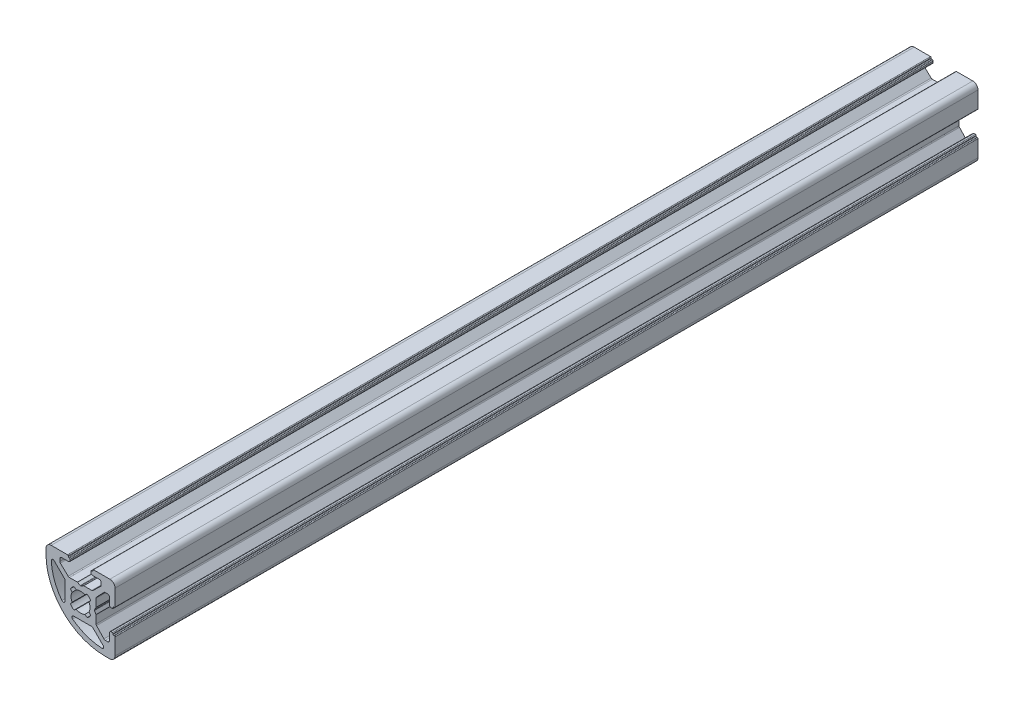
from build123d import *

# Parameters (mm, degrees)
EXTRUDE1_DEPTH = 250


with BuildPart() as part:
    # Sketch1 → Extrude1 (new body)
    with BuildSketch(Plane.XY):
        with BuildLine():
            Line((3.232233116, 4.565447254), (0.953589838, 4.565447254))
            ThreePointArc((0.953589838, 4.565447254), (0.901826028, 4.558632419), (0.853589836, 4.538652333))
            Line((0.853589836, 4.538652333), (0.100000003, 4.103567024))
            ThreePointArc((0.100000003, 4.103567024), (0, 4.076772104), (-0.100000003, 4.103567024))
            Line((-0.100000003, 4.103567024), (-0.853589836, 4.538652333))
            ThreePointArc((-0.853589836, 4.538652333), (-0.901826028, 4.558632419), (-0.953589838, 4.565447254))
            Line((-0.953589838, 4.565447254), (-3.232233116, 4.565447254))
            ThreePointArc((-3.232233116, 4.565447254), (-3.417445277, 4.601015929), (-3.576306433, 4.702661433))
            Line((-3.576306433, 4.702661433), (-5.844073317, 6.853456827))
            ThreePointArc((-5.844073317, 6.853456827), (-5.959367314, 7.018804885), (-6, 7.216242649))
            Line((-6, 7.216242649), (-6, 7.948478858))
            ThreePointArc((-6, 7.948478858), (-5.855954134, 8.296236342), (-5.50819665, 8.440282208))
            Line((-5.50819665, 8.440282208), (-3.49180335, 8.440282208))
            ThreePointArc((-3.49180335, 8.440282208), (-3.144045866, 8.584328074), (-3, 8.932085558))
            Line((-3, 8.932085558), (-3, 9.249999634))
            ThreePointArc((-3, 9.249999634), (-3.058578644, 9.39142099), (-3.2, 9.449999634))
            Line((-3.2, 9.449999634), (-3.350000366, 9.449999634))
            ThreePointArc((-3.350000366, 9.449999634), (-3.491421722, 9.508578278), (-3.550000366, 9.649999634))
            Line((-3.550000366, 9.649999634), (-3.550000366, 9.8))
            ThreePointArc((-3.550000366, 9.8), (-3.60857901, 9.941421356), (-3.750000366, 10))
            Line((-3.750000366, 10), (-8.50000115, 10))
            ThreePointArc((-8.50000115, 10), (-9.560660508, 9.560660508), (-10, 8.50000115))
            Line((-10, 8.50000115), (-10, 7))
            ThreePointArc((-10, 7), (-5.02081528, -5.02081528), (7, -10))
            Line((7, -10), (8.50000115, -10))
            ThreePointArc((8.50000115, -10), (9.560660508, -9.560660508), (10, -8.50000115))
            Line((10, -8.50000115), (10, -3.750000366))
            ThreePointArc((10, -3.750000366), (9.941421356, -3.60857901), (9.8, -3.550000366))
            Line((9.8, -3.550000366), (9.649999634, -3.550000366))
            ThreePointArc((9.649999634, -3.550000366), (9.508578278, -3.491421722), (9.449999634, -3.350000366))
            Line((9.449999634, -3.350000366), (9.449999634, -3.2))
            ThreePointArc((9.449999634, -3.2), (9.39142099, -3.058578644), (9.249999634, -3))
            Line((9.249999634, -3), (8.866638303, -3))
            ThreePointArc((8.866638303, -3), (8.518880819, -3.144045866), (8.374834953, -3.49180335))
            Line((8.374834953, -3.49180335), (8.374834953, -5.50819665))
            ThreePointArc((8.374834953, -5.50819665), (8.230789087, -5.855954134), (7.883031603, -6))
            Line((7.883031603, -6), (7.150795394, -6))
            ThreePointArc((7.150795394, -6), (6.95335763, -5.959367314), (6.788009572, -5.844073317))
            Line((6.788009572, -5.844073317), (4.637214178, -3.576306432))
            ThreePointArc((4.637214178, -3.576306432), (4.535568675, -3.417445276), (4.5, -3.232233115))
            Line((4.5, -3.232233115), (4.5, -0.953589838))
            ThreePointArc((4.5, -0.953589838), (4.493185165, -0.901826026), (4.473205078, -0.853589834))
            Line((4.473205078, -0.853589834), (4.038119764, -0.100000004))
            ThreePointArc((4.038119764, -0.100000004), (4.011324842, 0), (4.038119764, 0.100000004))
            Line((4.038119764, 0.100000004), (4.473205078, 0.853589834))
            ThreePointArc((4.473205078, 0.853589834), (4.493185165, 0.901826026), (4.5, 0.953589838))
            Line((4.5, 0.953589838), (4.5, 3.232233115))
            ThreePointArc((4.5, 3.232233115), (4.535568675, 3.417445276), (4.637214178, 3.576306432))
            Line((4.637214178, 3.576306432), (6.788009572, 5.844073317))
            ThreePointArc((6.788009572, 5.844073317), (6.95335763, 5.959367314), (7.150795394, 6))
            Line((7.150795394, 6), (7.883031603, 6))
            ThreePointArc((7.883031603, 6), (8.230789087, 5.855954134), (8.374834953, 5.50819665))
            Line((8.374834953, 5.50819665), (8.374834953, 3.49180335))
            ThreePointArc((8.374834953, 3.49180335), (8.518880819, 3.144045866), (8.866638303, 3))
            Line((8.866638303, 3), (9.249999634, 3))
            ThreePointArc((9.249999634, 3), (9.39142099, 3.058578644), (9.449999634, 3.2))
            Line((9.449999634, 3.2), (9.449999634, 3.350000366))
            ThreePointArc((9.449999634, 3.350000366), (9.508578278, 3.491421722), (9.649999634, 3.550000366))
            Line((9.649999634, 3.550000366), (9.8, 3.550000366))
            ThreePointArc((9.8, 3.550000366), (9.941421356, 3.60857901), (10, 3.750000366))
            Line((10, 3.750000366), (10, 8.50000115))
            ThreePointArc((10, 8.50000115), (9.560660508, 9.560660508), (8.50000115, 10))
            Line((8.50000115, 10), (3.750000366, 10))
            ThreePointArc((3.750000366, 10), (3.60857901, 9.941421356), (3.550000366, 9.8))
            Line((3.550000366, 9.8), (3.550000366, 9.649999634))
            ThreePointArc((3.550000366, 9.649999634), (3.491421722, 9.508578278), (3.350000366, 9.449999634))
            Line((3.350000366, 9.449999634), (3.2, 9.449999634))
            ThreePointArc((3.2, 9.449999634), (3.058578644, 9.39142099), (3, 9.249999634))
            Line((3, 9.249999634), (3, 8.932085558))
            ThreePointArc((3, 8.932085558), (3.144045866, 8.584328074), (3.49180335, 8.440282208))
            Line((3.49180335, 8.440282208), (5.50819665, 8.440282208))
            ThreePointArc((5.50819665, 8.440282208), (5.855954134, 8.296236342), (6, 7.948478858))
            Line((6, 7.948478858), (6, 7.216242649))
            ThreePointArc((6, 7.216242649), (5.959367314, 7.018804885), (5.844073317, 6.853456827))
            Line((5.844073317, 6.853456827), (3.576306433, 4.702661433))
            ThreePointArc((3.576306433, 4.702661433), (3.417445277, 4.601015929), (3.232233116, 4.565447254))
        make_face()
        with BuildLine():
            Line((1.258185436, 2.445295362), (1.887055008, 2.947714945))
            ThreePointArc((1.887055008, 2.947714945), (2.474873794, 2.474873674), (2.947715037, 1.887054865))
            Line((2.947715037, 1.887054865), (2.445295423, 1.258185317))
            ThreePointArc((2.445295423, 1.258185317), (2.75, -6.7e-08), (2.445295362, -1.258185436))
            Line((2.445295362, -1.258185436), (2.947714945, -1.887055008))
            ThreePointArc((2.947714945, -1.887055008), (2.474873674, -2.474873794), (1.887054865, -2.947715037))
            Line((1.887054865, -2.947715037), (1.258185317, -2.445295423))
            ThreePointArc((1.258185317, -2.445295423), (-6.7e-08, -2.75), (-1.258185436, -2.445295362))
            Line((-1.258185436, -2.445295362), (-1.887055008, -2.947714945))
            ThreePointArc((-1.887055008, -2.947714945), (-2.474873794, -2.474873674), (-2.947715037, -1.887054865))
            Line((-2.947715037, -1.887054865), (-2.445295423, -1.258185317))
            ThreePointArc((-2.445295423, -1.258185317), (-2.75, 6.7e-08), (-2.445295362, 1.258185436))
            Line((-2.445295362, 1.258185436), (-2.947714945, 1.887055008))
            ThreePointArc((-2.947714945, 1.887055008), (-2.474873674, 2.474873794), (-1.887054865, 2.947715037))
            Line((-1.887054865, 2.947715037), (-1.258185317, 2.445295423))
            ThreePointArc((-1.258185317, 2.445295423), (6.7e-08, 2.75), (1.258185436, 2.445295362))
        make_face(mode=Mode.SUBTRACT)
        with BuildLine():
            Line((3.232233163, -4.499999714), (-2.000000051, -4.499999587))
            ThreePointArc((-2.000000051, -4.499999587), (-2.474341709, -4.841885693), (-2.300000072, -5.399999581))
            ThreePointArc((-2.300000072, -5.399999581), (1.713541858, -7.57063318), (6.185210557, -8.478569349))
            ThreePointArc((6.185210557, -8.478569349), (6.668243282, -8.182681825), (6.565047479, -7.625707261))
            Line((6.565047479, -7.625707261), (3.585786542, -4.646446324))
            ThreePointArc((3.585786542, -4.646446324), (3.423574873, -4.53805995), (3.232233163, -4.499999714))
        make_face(mode=Mode.SUBTRACT)
        with BuildLine():
            Line((-4.646446492, 3.585787135), (-7.625707283, 6.565048217))
            ThreePointArc((-7.625707283, 6.565048217), (-8.182681843, 6.668244047), (-8.47856939, 6.185211338))
            ThreePointArc((-8.47856939, 6.185211338), (-7.570633447, 1.713542596), (-5.400000054, -2.299999441))
            ThreePointArc((-5.400000054, -2.299999441), (-4.841886176, -2.474341107), (-4.500000045, -1.999999467))
            Line((-4.500000045, -1.999999467), (-4.499999899, 3.232233748))
            ThreePointArc((-4.499999899, 3.232233748), (-4.538060126, 3.42357546), (-4.646446492, 3.585787135))
        make_face(mode=Mode.SUBTRACT)
    extrude(amount=EXTRUDE1_DEPTH)


solid = part.part
